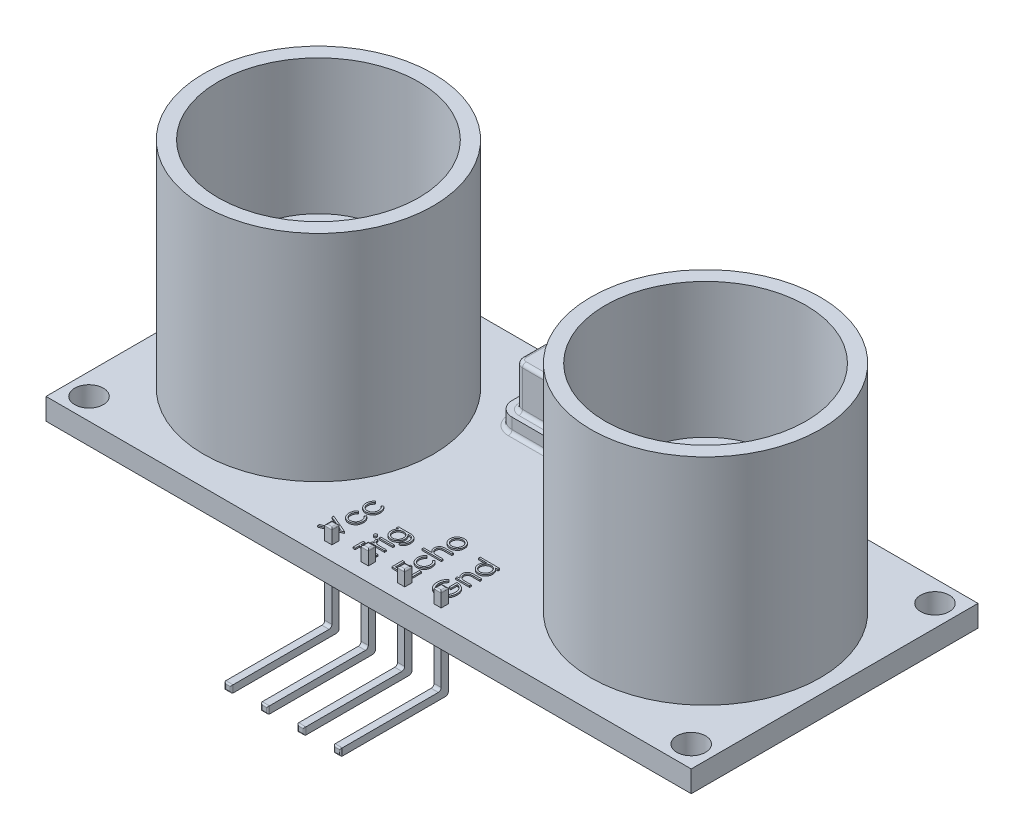
from build123d import *

# Parameters (mm, degrees)
SKETCH1_W                = 45
SKETCH1_H                = 20
SKETCH1_R                = 1
BOSS_EXTRUDE1_DEPTH      = 1.5
BOSS_EXTRUDE2_DEPTH      = 1
BOSS_EXTRUDE3_DEPTH      = 3
FILLET1_R                = 0.25
SKETCH5_R                = 8
BOSS_EXTRUDE4_DEPTH      = 15
SKETCH6_R                = 7
CUT_EXTRUDE1_DEPTH       = 13
SKETCH7_R                = 5
BOSS_EXTRUDE5_DEPTH      = 5
BOSS_EXTRUDE6_DEPTH      = 1
BOSS_EXTRUDE6_DEPTH_BACK = 5.5
SKETCH8_W                = 0.5
SKETCH8_H                = 0.5
SKETCH9_W                = 0.5
SKETCH9_H                = 0.5
BOSS_EXTRUDE7_DEPTH      = 7
LPATTERN1_COUNT          = 4
LPATTERN1_PITCH          = 2.54
FILLET3_R                = 0.2
FILLET2_R                = 0.1
SKETCH10_W               = 0.966746795
SKETCH10_H               = 0.118723291
BOSS_EXTRUDE8_DEPTH      = 0.1


with BuildPart() as part:
    # Sketch1 → Boss-Extrude1 (new body)
    with BuildSketch(Plane(origin=(0, 0, 0), x_dir=(1, 0, 0), z_dir=(0, 1, 0))):
        with Locations((22.5, 10)):
            Rectangle(SKETCH1_W, SKETCH1_H)
        with Locations(Location((1.5, 18.5, 0), (0, 0, 270))):
            Circle(SKETCH1_R, mode=Mode.SUBTRACT)
        with Locations(Location((43.5, 18.5, 0), (0, 0, 90))):
            Circle(SKETCH1_R, mode=Mode.SUBTRACT)
        with Locations(Location((43.5, 1.5, 0), (0, 0, 270))):
            Circle(SKETCH1_R, mode=Mode.SUBTRACT)
        with Locations(Location((1.5, 1.5, 0), (0, 0, 90))):
            Circle(SKETCH1_R, mode=Mode.SUBTRACT)
    extrude(amount=BOSS_EXTRUDE1_DEPTH)

    # Sketch2 → Boss-Extrude2 (add)
    with BuildSketch(Plane(origin=(0, 1.5, 0), x_dir=(1, 0, 0), z_dir=(0, 1, 0))):
        with BuildLine():
            Line((18.5, 19), (26.5, 19))
            ThreePointArc((26.5, 19), (27.207106781, 18.707106781), (27.5, 18))
            Line((27.5, 18), (27.5, 15))
            ThreePointArc((27.5, 15), (27.207106781, 14.292893219), (26.5, 14))
            Line((26.5, 14), (18.5, 14))
            ThreePointArc((18.5, 14), (17.792893219, 14.292893219), (17.5, 15))
            Line((17.5, 15), (17.5, 18))
            ThreePointArc((17.5, 18), (17.792893219, 18.707106781), (18.5, 19))
        make_face()
    extrude(amount=BOSS_EXTRUDE2_DEPTH)

    # Sketch4 → Boss-Extrude3 (add)
    with BuildSketch(Plane(origin=(0, 2.5, 0), x_dir=(1, 0, 0), z_dir=(0, 1, 0))):
        with BuildLine():
            Line((18.647529622, 18.413328726), (26.352470378, 18.413328726))
            ThreePointArc((26.352470378, 18.413328726), (26.706023768, 18.266882117), (26.852470378, 17.913328726))
            Line((26.852470378, 17.913328726), (26.852470378, 15.086671274))
            ThreePointArc((26.852470378, 15.086671274), (26.706023768, 14.733117883), (26.352470378, 14.586671274))
            Line((26.352470378, 14.586671274), (18.647529622, 14.586671274))
            ThreePointArc((18.647529622, 14.586671274), (18.293976232, 14.733117883), (18.147529622, 15.086671274))
            Line((18.147529622, 15.086671274), (18.147529622, 17.913328726))
            ThreePointArc((18.147529622, 17.913328726), (18.293976232, 18.266882117), (18.647529622, 18.413328726))
        make_face()
    extrude(amount=BOSS_EXTRUDE3_DEPTH)

    # Fillet1
    fillet1_edges = [part.edges().sort_by_distance(p)[0] for p in [
        (27.207106781, 1.5, -18.707106781),
        (22.5, 1.5, -19),
        (17.792893219, 1.5, -18.707106781),
        (17.5, 1.5, -16.5),
        (17.792893219, 1.5, -14.292893219),
        (22.5, 1.5, -14),
        (27.207106781, 1.5, -14.292893219),
        (27.5, 1.5, -16.5),
        (26.706023768, 2.5, -18.266882117),
        (22.5, 2.5, -18.413328726),
        (18.293976232, 2.5, -18.266882117),
        (18.147529622, 2.5, -16.5),
        (18.293976232, 2.5, -14.733117883),
        (22.5, 2.5, -14.586671274),
        (26.706023768, 2.5, -14.733117883),
        (26.852470378, 2.5, -16.5),
        (26.706023768, 5.5, -18.266882117),
        (22.5, 5.5, -18.413328726),
        (18.293976232, 5.5, -18.266882117),
        (18.147529622, 5.5, -16.5),
        (18.293976232, 5.5, -14.733117883),
        (22.5, 5.5, -14.586671274),
        (26.706023768, 5.5, -14.733117883),
        (26.852470378, 5.5, -16.5),
    ]]
    fillet(fillet1_edges, radius=FILLET1_R)

    # Sketch5 → Boss-Extrude4 (add)
    with BuildSketch(Plane(origin=(0, 1.5, 0), x_dir=(1, 0, 0), z_dir=(0, 1, 0))):
        with Locations(Location((9, 10, 0), (0, 0, 90))):
            Circle(SKETCH5_R)
        with Locations(Location((36, 10, 0), (0, 0, 90))):
            Circle(SKETCH5_R)
    extrude(amount=BOSS_EXTRUDE4_DEPTH)

    # Sketch6 → Cut-Extrude1 (cut)
    with BuildSketch(Plane(origin=(0, 16.5, 0), x_dir=(1, 0, 0), z_dir=(0, 1, 0))):
        with Locations(Location((9, 10, 0), (0, 0, 270))):
            Circle(SKETCH6_R)
        with Locations(Location((36, 10, 0), (0, 0, 270))):
            Circle(SKETCH6_R)
    extrude(amount=-CUT_EXTRUDE1_DEPTH, mode=Mode.SUBTRACT)

    # Sketch7 → Boss-Extrude5 (add)
    with BuildSketch(Plane(origin=(0, 3.5, 0), x_dir=(1, 0, 0), z_dir=(0, 1, 0))):
        with Locations(Location((9, 10, 0), (0, 0, 90))):
            Circle(SKETCH7_R)
        with Locations(Location((36, 10, 0), (0, 0, 90))):
            Circle(SKETCH7_R)
    extrude(amount=BOSS_EXTRUDE5_DEPTH)

    # Sketch8 → Boss-Extrude6 (add, two sides: drawn at the far end of the back side and taken through both)
    with BuildSketch(Plane(origin=(0, 1.5, 0), x_dir=(1, 0, 0), z_dir=(0, 1, 0)).offset(-BOSS_EXTRUDE6_DEPTH_BACK)):
        with Locations((21.23, 1.25)):
            Rectangle(SKETCH8_W, SKETCH8_H)
        with Locations((23.77, 1.25)):
            Rectangle(SKETCH8_W, SKETCH8_H)
        with Locations((26.31, 1.25)):
            Rectangle(SKETCH8_W, SKETCH8_H)
        with Locations((18.69, 1.25)):
            Rectangle(SKETCH8_W, SKETCH8_H)
    extrude(amount=BOSS_EXTRUDE6_DEPTH + BOSS_EXTRUDE6_DEPTH_BACK)

    # Sketch9 → Boss-Extrude7 (add)
    with BuildSketch(Plane.XY.offset(-1)):
        with Locations((18.69, -3.75)):
            Rectangle(SKETCH9_W, SKETCH9_H)
    boss_extrude7 = extrude(amount=BOSS_EXTRUDE7_DEPTH)

    # LPattern1: Boss-Extrude7 ×4
    with Locations(*[(i * LPATTERN1_PITCH, 0, 0) for i in range(1, LPATTERN1_COUNT)]):
        add(boss_extrude7)

    # Fillet3
    fillet3_edges = [part.edges().sort_by_distance(p)[0] for p in [
        (21.23, -4, -1.5),
        (23.77, -4, -1.5),
        (26.31, -4, -1.5),
        (18.69, -4, -1.5),
        (18.69, -3.5, -1),
        (21.23, -3.5, -1),
        (23.77, -3.5, -1),
        (26.31, -3.5, -1),
    ]]
    fillet(fillet3_edges, radius=FILLET3_R)

    # Fillet2
    fillet2_edges = [part.edges().sort_by_distance(p)[0] for p in [
        (20.98, 2.5, -1.25),
        (21.23, 2.5, -1),
        (21.48, 2.5, -1.25),
        (21.23, 2.5, -1.5),
        (23.52, 2.5, -1.25),
        (23.77, 2.5, -1),
        (24.02, 2.5, -1.25),
        (23.77, 2.5, -1.5),
        (26.06, 2.5, -1.25),
        (26.31, 2.5, -1),
        (26.56, 2.5, -1.25),
        (26.31, 2.5, -1.5),
        (18.44, 2.5, -1.25),
        (18.69, 2.5, -1),
        (18.94, 2.5, -1.25),
        (18.69, 2.5, -1.5),
        (18.44, -3.75, 6),
        (18.69, -4, 6),
        (18.94, -3.75, 6),
        (18.69, -3.5, 6),
        (20.98, -3.75, 6),
        (21.23, -4, 6),
        (21.48, -3.75, 6),
        (21.23, -3.5, 6),
        (23.52, -3.75, 6),
        (23.77, -4, 6),
        (24.02, -3.75, 6),
        (23.77, -3.5, 6),
        (26.06, -3.75, 6),
        (26.31, -4, 6),
        (26.56, -3.75, 6),
        (26.31, -3.5, 6),
    ]]
    fillet(fillet2_edges, radius=FILLET2_R)

    # Sketch10 → Boss-Extrude8 (add)
    # profile 1 of 15: a face of its own
    with BuildSketch(Plane(origin=(0, 1.5, 0), x_dir=(1, 0, 0), z_dir=(0, 1, 0))):
        Polygon((17.367083333, 1.56784188), (17.367083333, 1.695045406), (18.409622229, 2.136017628), (17.367083333, 2.57698985), (17.367083333, 2.704193376), (18.69, 2.144497863), (18.69, 2.127537393), align=None)
    # profile 2 of 15: a face of its own
    with BuildSketch(Plane(origin=(0, 1.5, 0), x_dir=(1, 0, 0), z_dir=(0, 1, 0))):
        with BuildLine():
            Line((17.932874015, 3.874465812), (17.994620726, 3.775088058))
            add(Edge.make_bspline(
                [(17.994620726, 3.775088058), (17.981078447, 3.764191055), (17.954422768, 3.742742155), (17.92002318, 3.70549667), (17.8904779, 3.665804856), (17.866399398, 3.622988451), (17.847794862, 3.577107508), (17.834629874, 3.528342966), (17.826426187, 3.476701779), (17.825493781, 3.441298564), (17.825016026, 3.423158303)],
                knots=[0, 0, 0, 0, 1.026593902, 2.0206758, 2.988051866, 3.946915611, 4.916868779, 5.907761954, 6.927957743, 8, 8, 8, 8], degree=3))
            add(Edge.make_bspline(
                [(17.825016026, 3.423158303), (17.825415487, 3.408659531), (17.826202215, 3.380104593), (17.831119872, 3.338184707), (17.840055988, 3.298254413), (17.851830308, 3.260063431), (17.867610923, 3.223883392), (17.886815801, 3.189619503), (17.909135311, 3.156967845), (17.934992868, 3.126874612), (17.963113793, 3.099346981), (17.993258791, 3.075497094), (18.02452494, 3.054732242), (18.057693009, 3.038439216), (18.092004196, 3.025106042), (18.12810616, 3.016334454), (18.165536389, 3.010489167), (18.191056713, 3.009820403), (18.203976529, 3.009481838)],
                knots=[0, 0, 0, 0, 1.112346261, 2.190735716, 3.231507886, 4.247384806, 5.251966152, 6.253067467, 7.256802811, 8.280671706, 9.291813951, 10.270744147, 11.225547591, 12.165006084, 13.100104208, 14.043489273, 15.009504848, 16, 16, 16, 16], degree=3))
            add(Edge.make_bspline(
                [(18.203976529, 3.009481838), (18.220895807, 3.010164545), (18.254592969, 3.011524255), (18.30424988, 3.0218659), (18.352171356, 3.039170198), (18.398098323, 3.062547501), (18.440652535, 3.092221132), (18.478822857, 3.127057213), (18.511863772, 3.167092894), (18.539256733, 3.211970671), (18.561278123, 3.260638092), (18.576966912, 3.312568264), (18.586436111, 3.367336936), (18.587628983, 3.404834723), (18.588237179, 3.423953325)],
                knots=[0, 0, 0, 0, 0.96628757, 1.924499989, 2.884001032, 3.87047137, 4.860396324, 5.839257425, 6.814467993, 7.816059692, 8.834901047, 9.858382822, 10.908076205, 12, 12, 12, 12], degree=3))
            add(Edge.make_bspline(
                [(18.588237179, 3.423953325), (18.587746, 3.441474481), (18.586780703, 3.475908202), (18.578643268, 3.526242265), (18.565322013, 3.574162053), (18.546745372, 3.619665862), (18.522733484, 3.662670544), (18.493115583, 3.702898238), (18.458743713, 3.741149405), (18.432165194, 3.763637846), (18.418632479, 3.775088058)],
                knots=[0, 0, 0, 0, 1.039848629, 2.043578496, 3.018386758, 3.987534228, 4.954977003, 5.934852016, 6.948509513, 8, 8, 8, 8], degree=3))
            Line((18.418632479, 3.775088058), (18.483824286, 3.874465812))
            add(Edge.make_bspline(
                [(18.483824286, 3.874465812), (18.492476435, 3.868574032), (18.509752017, 3.856810027), (18.534110359, 3.837144823), (18.556910519, 3.815932863), (18.578121934, 3.793256901), (18.598252197, 3.769413025), (18.616338953, 3.743586702), (18.633398841, 3.716610688), (18.64874954, 3.688168298), (18.66254806, 3.6585536), (18.674413176, 3.627808264), (18.684607233, 3.596065895), (18.69271004, 3.563289169), (18.69917753, 3.529413469), (18.703468958, 3.494526405), (18.706672413, 3.458639992), (18.706863619, 3.434384447), (18.70696047, 3.422098274)],
                knots=[0, 0, 0, 0, 0.954134338, 1.905101784, 2.851144739, 3.791306361, 4.734911809, 5.6936923, 6.663572882, 7.643865596, 8.638447847, 9.640600242, 10.646758161, 11.676244097, 12.717260333, 13.78922464, 14.880174919, 16, 16, 16, 16], degree=3))
            add(Edge.make_bspline(
                [(18.70696047, 3.422098274), (18.706623028, 3.403346786), (18.705961639, 3.366593735), (18.698709188, 3.312795755), (18.687735226, 3.261398394), (18.672118193, 3.212311332), (18.65149411, 3.165834665), (18.626878531, 3.121581475), (18.597457983, 3.080008426), (18.563931401, 3.041388056), (18.527543724, 3.006069741), (18.488505212, 2.975337252), (18.447678502, 2.949292428), (18.404806253, 2.927837553), (18.360064262, 2.911061842), (18.313179197, 2.899512363), (18.264548852, 2.892060247), (18.231388304, 2.891196462), (18.214576823, 2.890758547)],
                knots=[0, 0, 0, 0, 1.113096611, 2.181677437, 3.217994567, 4.231807234, 5.234933164, 6.233258928, 7.234764453, 8.254006763, 9.267004511, 10.242118657, 11.199842941, 12.138404996, 13.084707599, 14.031460992, 15.002005182, 16, 16, 16, 16], degree=3))
            add(Edge.make_bspline(
                [(18.214576823, 2.890758547), (18.203170093, 2.890925241), (18.180480225, 2.891256822), (18.146804411, 2.895059991), (18.113577074, 2.899973104), (18.081219394, 2.908298308), (18.049240609, 2.917914261), (18.018026163, 2.930189239), (17.987431004, 2.944588391), (17.957533946, 2.960936598), (17.928826828, 2.979339784), (17.901705651, 2.999705607), (17.875844609, 3.021267008), (17.852136521, 3.045032681), (17.829633258, 3.069994098), (17.808935991, 3.096857462), (17.78998389, 3.125468691), (17.772426512, 3.155398102), (17.75679363, 3.186628276), (17.743325115, 3.21897044), (17.731814766, 3.25222971), (17.722702169, 3.286459288), (17.715060464, 3.321431978), (17.710253421, 3.357423377), (17.706856824, 3.394295794), (17.706482328, 3.419263398), (17.706292735, 3.431903546)],
                knots=[0, 0, 0, 0, 0.990994727, 1.971252077, 2.943264845, 3.907940874, 4.872158414, 5.844625996, 6.82015047, 7.809835459, 8.804511986, 9.781214284, 10.756496977, 11.728388426, 12.696359165, 13.676225489, 14.672885716, 15.677705647, 16.690706858, 17.706033469, 18.721040654, 19.747369689, 20.783475414, 21.830280724, 22.901553713, 24, 24, 24, 24], degree=3))
            add(Edge.make_bspline(
                [(17.706292735, 3.431903546), (17.706641152, 3.447733249), (17.707336244, 3.479313532), (17.713187342, 3.526159875), (17.722005936, 3.57231761), (17.735081122, 3.616970323), (17.750877706, 3.659600482), (17.768723381, 3.699399693), (17.789007628, 3.735766907), (17.811606262, 3.769022904), (17.837349713, 3.799158469), (17.865975945, 3.826945987), (17.897691011, 3.852568538), (17.921049559, 3.867106482), (17.932874015, 3.874465812)],
                knots=[0, 0, 0, 0, 1.095139042, 2.184804066, 3.262657822, 4.34424993, 5.400369085, 6.407210964, 7.359649996, 8.278719237, 9.185177137, 10.097389079, 11.036869154, 12, 12, 12, 12], degree=3))
        make_face()
    # profile 3 of 15: a face of its own
    with BuildSketch(Plane(origin=(0, 1.5, 0), x_dir=(1, 0, 0), z_dir=(0, 1, 0))):
        with BuildLine():
            Line((17.932874015, 5.061698718), (17.994620726, 4.962320964))
            add(Edge.make_bspline(
                [(17.994620726, 4.962320964), (17.981078447, 4.951423961), (17.954422768, 4.929975061), (17.92002318, 4.892729576), (17.8904779, 4.853037762), (17.866399398, 4.810221357), (17.847794862, 4.764340414), (17.834629874, 4.715575872), (17.826426187, 4.663934685), (17.825493781, 4.62853147), (17.825016026, 4.610391209)],
                knots=[0, 0, 0, 0, 1.026593902, 2.0206758, 2.988051866, 3.946915611, 4.916868779, 5.907761954, 6.927957743, 8, 8, 8, 8], degree=3))
            add(Edge.make_bspline(
                [(17.825016026, 4.610391209), (17.825415487, 4.595892437), (17.826202215, 4.567337499), (17.831119872, 4.525417613), (17.840055988, 4.485487319), (17.851830308, 4.447296337), (17.867610923, 4.411116298), (17.886815801, 4.376852409), (17.909135311, 4.344200751), (17.934992868, 4.314107518), (17.963113793, 4.286579887), (17.993258791, 4.26273), (18.02452494, 4.241965148), (18.057693009, 4.225672122), (18.092004196, 4.212338948), (18.12810616, 4.20356736), (18.165536389, 4.197722073), (18.191056713, 4.197053309), (18.203976529, 4.196714744)],
                knots=[0, 0, 0, 0, 1.112346261, 2.190735716, 3.231507886, 4.247384806, 5.251966152, 6.253067467, 7.256802811, 8.280671706, 9.291813951, 10.270744147, 11.225547591, 12.165006084, 13.100104208, 14.043489273, 15.009504848, 16, 16, 16, 16], degree=3))
            add(Edge.make_bspline(
                [(18.203976529, 4.196714744), (18.220895807, 4.197397451), (18.254592969, 4.198757161), (18.30424988, 4.209098806), (18.352171356, 4.226403104), (18.398098323, 4.249780407), (18.440652535, 4.279454038), (18.478822857, 4.314290119), (18.511863772, 4.3543258), (18.539256733, 4.399203577), (18.561278123, 4.447870998), (18.576966912, 4.49980117), (18.586436111, 4.554569841), (18.587628983, 4.592067629), (18.588237179, 4.611186231)],
                knots=[0, 0, 0, 0, 0.96628757, 1.924499989, 2.884001032, 3.87047137, 4.860396324, 5.839257425, 6.814467993, 7.816059692, 8.834901047, 9.858382822, 10.908076205, 12, 12, 12, 12], degree=3))
            add(Edge.make_bspline(
                [(18.588237179, 4.611186231), (18.587746, 4.628707387), (18.586780703, 4.663141108), (18.578643268, 4.713475171), (18.565322013, 4.761394959), (18.546745372, 4.806898768), (18.522733484, 4.84990345), (18.493115583, 4.890131144), (18.458743713, 4.928382311), (18.432165194, 4.950870752), (18.418632479, 4.962320964)],
                knots=[0, 0, 0, 0, 1.039848629, 2.043578496, 3.018386758, 3.987534228, 4.954977003, 5.934852016, 6.948509513, 8, 8, 8, 8], degree=3))
            Line((18.418632479, 4.962320964), (18.483824286, 5.061698718))
            add(Edge.make_bspline(
                [(18.483824286, 5.061698718), (18.492476435, 5.055806938), (18.509752017, 5.044042933), (18.534110359, 5.024377729), (18.556910519, 5.003165769), (18.578121934, 4.980489807), (18.598252197, 4.956645931), (18.616338953, 4.930819608), (18.633398841, 4.903843594), (18.64874954, 4.875401204), (18.66254806, 4.845786506), (18.674413176, 4.81504117), (18.684607233, 4.783298801), (18.69271004, 4.750522075), (18.69917753, 4.716646375), (18.703468958, 4.681759311), (18.706672413, 4.645872898), (18.706863619, 4.621617353), (18.70696047, 4.60933118)],
                knots=[0, 0, 0, 0, 0.954134338, 1.905101784, 2.851144739, 3.791306361, 4.734911809, 5.6936923, 6.663572882, 7.643865596, 8.638447847, 9.640600242, 10.646758161, 11.676244097, 12.717260333, 13.78922464, 14.880174919, 16, 16, 16, 16], degree=3))
            add(Edge.make_bspline(
                [(18.70696047, 4.60933118), (18.706623028, 4.590579692), (18.705961639, 4.553826641), (18.698709188, 4.500028661), (18.687735226, 4.4486313), (18.672118193, 4.399544238), (18.65149411, 4.353067571), (18.626878531, 4.308814381), (18.597457983, 4.267241332), (18.563931401, 4.228620962), (18.527543724, 4.193302647), (18.488505212, 4.162570158), (18.447678502, 4.136525334), (18.404806253, 4.115070459), (18.360064262, 4.098294748), (18.313179197, 4.086745269), (18.264548852, 4.079293153), (18.231388304, 4.078429368), (18.214576823, 4.077991453)],
                knots=[0, 0, 0, 0, 1.113096611, 2.181677437, 3.217994567, 4.231807234, 5.234933164, 6.233258928, 7.234764453, 8.254006763, 9.267004511, 10.242118657, 11.199842941, 12.138404996, 13.084707599, 14.031460992, 15.002005182, 16, 16, 16, 16], degree=3))
            add(Edge.make_bspline(
                [(18.214576823, 4.077991453), (18.203170093, 4.078158147), (18.180480225, 4.078489728), (18.146804411, 4.082292897), (18.113577074, 4.08720601), (18.081219394, 4.095531214), (18.049240609, 4.105147167), (18.018026163, 4.117422145), (17.987431004, 4.131821297), (17.957533946, 4.148169504), (17.928826828, 4.16657269), (17.901705651, 4.186938513), (17.875844609, 4.208499914), (17.852136521, 4.232265587), (17.829633258, 4.257227004), (17.808935991, 4.284090368), (17.78998389, 4.312701597), (17.772426512, 4.342631008), (17.75679363, 4.373861182), (17.743325115, 4.406203346), (17.731814766, 4.439462616), (17.722702169, 4.473692194), (17.715060464, 4.508664884), (17.710253421, 4.544656283), (17.706856824, 4.5815287), (17.706482328, 4.606496304), (17.706292735, 4.619136452)],
                knots=[0, 0, 0, 0, 0.990994727, 1.971252077, 2.943264845, 3.907940874, 4.872158414, 5.844625996, 6.82015047, 7.809835459, 8.804511986, 9.781214284, 10.756496977, 11.728388426, 12.696359165, 13.676225489, 14.672885716, 15.677705647, 16.690706858, 17.706033469, 18.721040654, 19.747369689, 20.783475414, 21.830280724, 22.901553713, 24, 24, 24, 24], degree=3))
            add(Edge.make_bspline(
                [(17.706292735, 4.619136452), (17.706641152, 4.634966155), (17.707336244, 4.666546437), (17.713187342, 4.713392781), (17.722005936, 4.759550516), (17.735081122, 4.804203229), (17.750877706, 4.846833388), (17.768723381, 4.886632599), (17.789007628, 4.922999813), (17.811606262, 4.95625581), (17.837349713, 4.986391375), (17.865975945, 5.014178893), (17.897691011, 5.039801444), (17.921049559, 5.054339388), (17.932874015, 5.061698718)],
                knots=[0, 0, 0, 0, 1.095139042, 2.184804066, 3.262657822, 4.34424993, 5.400369085, 6.407210964, 7.359649996, 8.278719237, 9.185177137, 10.097389079, 11.036869154, 12, 12, 12, 12], degree=3))
        make_face()
    # profile 4 of 15: a face of its own
    with BuildSketch(Plane(origin=(0, 1.5, 0), x_dir=(1, 0, 0), z_dir=(0, 1, 0))):
        Polygon((20.042767094, 1.51696047), (19.907083333, 1.51696047), (19.907083333, 2.212339744), (20.042767094, 2.212339744), (20.042767094, 1.924011752), (21.23, 1.924011752), (21.23, 1.805288462), (20.042767094, 1.805288462), align=None)
    # profile 5 of 15: a face of its own
    with BuildSketch(Plane(origin=(0, 1.5, 0), x_dir=(1, 0, 0), z_dir=(0, 1, 0))):
        with BuildLine():
            Line((20.263253205, 2.381944444), (20.263253205, 2.500667735))
            Line((20.263253205, 2.500667735), (20.405562149, 2.500667735))
            add(Edge.make_bspline(
                [(20.405562149, 2.500667735), (20.392305949, 2.509426926), (20.366953569, 2.52617881), (20.333468425, 2.554152759), (20.305427447, 2.582500812), (20.283365381, 2.611967337), (20.266691847, 2.642263439), (20.254975877, 2.673133645), (20.247710448, 2.704653445), (20.246765939, 2.725886432), (20.246292735, 2.736524272)],
                knots=[0, 0, 0, 0, 1.280091057, 2.448164201, 3.510831157, 4.48793739, 5.405868014, 6.289422536, 7.142991551, 8, 8, 8, 8], degree=3))
            add(Edge.make_bspline(
                [(20.246292735, 2.736524272), (20.246742726, 2.744774104), (20.247668611, 2.761748669), (20.254173893, 2.787444469), (20.264559931, 2.813919226), (20.27432692, 2.830981974), (20.279418653, 2.839877137)],
                knots=[0, 0, 0, 0, 0.901110191, 1.854092781, 2.881294221, 4, 4, 4, 4], degree=3))
            Line((20.279418653, 2.839877137), (20.382241503, 2.77468533))
            add(Edge.make_bspline(
                [(20.382241503, 2.77468533), (20.379693843, 2.76897448), (20.374857896, 2.758134193), (20.369134577, 2.742276365), (20.365764573, 2.727655741), (20.365254034, 2.718341063), (20.365016026, 2.713998648)],
                knots=[0, 0, 0, 0, 1.180555205, 2.24091978, 3.179933427, 4, 4, 4, 4], degree=3))
            add(Edge.make_bspline(
                [(20.365016026, 2.713998648), (20.365646067, 2.70446862), (20.366931168, 2.685030127), (20.377178354, 2.656586914), (20.393258527, 2.628739377), (20.411569089, 2.606836324), (20.429157985, 2.589817241), (20.444552148, 2.577577549), (20.461973375, 2.566592243), (20.480748296, 2.555936204), (20.501348109, 2.54603594), (20.523806419, 2.537188599), (20.547937775, 2.528914632), (20.564716869, 2.524255115), (20.573311799, 2.521868323)],
                knots=[0, 0, 0, 0, 1.125322384, 2.295331465, 3.535939348, 4.916963136, 5.656144286, 6.429838446, 7.238666481, 8.090384391, 8.983239461, 9.940052224, 10.944811494, 12, 12, 12, 12], degree=3))
            add(Edge.make_bspline(
                [(20.573311799, 2.521868323), (20.580975663, 2.520076499), (20.598035665, 2.516087844), (20.626526528, 2.512313226), (20.66016589, 2.508433533), (20.69899283, 2.505784094), (20.743156601, 2.503281345), (20.792466679, 2.501898723), (20.847058594, 2.500711725), (20.885136241, 2.500682866), (20.905100995, 2.500667735)],
                knots=[0, 0, 0, 0, 0.566841273, 1.261806378, 2.068780918, 3.007109044, 4.065315289, 5.256255371, 6.561408263, 8, 8, 8, 8], degree=3))
            Line((20.905100995, 2.500667735), (21.23, 2.500667735))
            Line((21.23, 2.500667735), (21.23, 2.381944444))
            Line((21.23, 2.381944444), (20.263253205, 2.381944444))
        make_face()
    # profile 6 of 15: a face of its own
    with BuildSketch(Plane(origin=(0, 1.5, 0), x_dir=(1, 0, 0), z_dir=(0, 1, 0))):
        with BuildLine():
            add(Edge.make_bspline(
                [(19.856201923, 3.017432058), (19.856543671, 3.024799311), (19.85721288, 3.039225808), (19.862943557, 3.060087549), (19.872657426, 3.079083503), (19.885689925, 3.095932825), (19.901016649, 3.110391127), (19.918880169, 3.120513598), (19.938179119, 3.127019474), (19.951640775, 3.127805118), (19.958494758, 3.128205128)],
                knots=[0, 0, 0, 0, 1.055194115, 2.066272739, 3.074728998, 4.095836921, 5.109056067, 6.073838105, 7.019297344, 8, 8, 8, 8], degree=3))
            add(Edge.make_bspline(
                [(19.958494758, 3.128205128), (19.965170821, 3.127796098), (19.978368606, 3.126987492), (19.997332984, 3.120518623), (20.014948293, 3.110304861), (20.030245258, 3.095942096), (20.043270552, 3.079081046), (20.052986331, 3.060088202), (20.058716502, 3.039225636), (20.05938578, 3.024799253), (20.059727564, 3.017432058)],
                knots=[0, 0, 0, 0, 0.96129708, 1.900370562, 2.859976407, 3.87933698, 4.906634145, 5.921202961, 6.938410037, 8, 8, 8, 8], degree=3))
            add(Edge.make_bspline(
                [(20.059727564, 3.017432058), (20.059398831, 3.010149109), (20.058758994, 2.9959738), (20.052873898, 2.975424428), (20.043267227, 2.956590445), (20.030330544, 2.939708262), (20.014854348, 2.925636136), (19.997343734, 2.915393614), (19.978365869, 2.908939685), (19.965169901, 2.908129066), (19.958494758, 2.907719017)],
                knots=[0, 0, 0, 0, 1.054934014, 2.053291228, 3.073705704, 4.106921865, 5.123545215, 6.088680038, 7.033164197, 8, 8, 8, 8], degree=3))
            add(Edge.make_bspline(
                [(19.958494758, 2.907719017), (19.951641729, 2.908120083), (19.938181947, 2.9089078), (19.918869241, 2.915398452), (19.901111352, 2.925550819), (19.88560469, 2.93971758), (19.872660731, 2.956587965), (19.863055985, 2.975425068), (19.857170389, 2.99597363), (19.856530621, 3.010149051), (19.856201923, 3.017432058)],
                knots=[0, 0, 0, 0, 0.98631895, 1.937192651, 2.907499808, 3.917963147, 4.944918757, 5.95915025, 6.951458133, 8, 8, 8, 8], degree=3))
        make_face()
    # profile 7 of 15: a face of its own
    with BuildSketch(Plane(origin=(0, 1.5, 0), x_dir=(1, 0, 0), z_dir=(0, 1, 0))):
        with Locations((20.746626603, 3.017962073)):
            Rectangle(SKETCH10_W, SKETCH10_H)
    # profile 8 of 15: a face of its own
    with BuildSketch(Plane(origin=(0, 1.5, 0), x_dir=(1, 0, 0), z_dir=(0, 1, 0))):
        with BuildLine():
            Line((20.263253205, 4.196714744), (20.263253205, 4.315438034))
            Line((20.263253205, 4.315438034), (21.030449469, 4.315438034))
            add(Edge.make_bspline(
                [(21.030449469, 4.315438034), (21.04679225, 4.315333319), (21.078337755, 4.315131193), (21.123951271, 4.313675617), (21.166082798, 4.310606194), (21.204924485, 4.307125532), (21.240296294, 4.302118589), (21.272303773, 4.296004307), (21.300977638, 4.289111655), (21.318638515, 4.283056394), (21.326992688, 4.280192057)],
                knots=[0, 0, 0, 0, 1.307562039, 2.523909702, 3.650326591, 4.686913197, 5.643429486, 6.506965704, 7.293745905, 8, 8, 8, 8], degree=3))
            add(Edge.make_bspline(
                [(21.326992688, 4.280192057), (21.337851889, 4.275962771), (21.359245608, 4.267630651), (21.389572636, 4.252025959), (21.418126018, 4.234549555), (21.44475472, 4.214593896), (21.469294922, 4.192225004), (21.492355447, 4.168099787), (21.513068715, 4.14137188), (21.531683505, 4.112509303), (21.548777058, 4.082094804), (21.563360489, 4.049899684), (21.57552369, 4.016096906), (21.585531894, 3.980842441), (21.593606075, 3.944138346), (21.598993284, 3.905862442), (21.602620794, 3.866144079), (21.602958837, 3.839139888), (21.603130342, 3.825439453)],
                knots=[0, 0, 0, 0, 0.98202571, 1.934689484, 2.871054655, 3.802072519, 4.735470746, 5.668036537, 6.612630213, 7.581518814, 8.561763468, 9.551722253, 10.55777311, 11.588015789, 12.63986657, 13.723744117, 14.845153492, 16, 16, 16, 16], degree=3))
            add(Edge.make_bspline(
                [(21.603130342, 3.825439453), (21.602766013, 3.805455874), (21.60205457, 3.766433032), (21.595254214, 3.709422673), (21.584285149, 3.655455223), (21.568656791, 3.604924001), (21.549330905, 3.558337418), (21.527192062, 3.515955641), (21.501793966, 3.478169343), (21.472879108, 3.444104638), (21.438496849, 3.413359482), (21.397978285, 3.38443398), (21.350705964, 3.3565919), (21.316010506, 3.340275183), (21.29784188, 3.331730769)],
                knots=[0, 0, 0, 0, 1.157856589, 2.260999188, 3.322382479, 4.345906448, 5.321474636, 6.242187631, 7.112686896, 7.955149481, 8.825136643, 9.778649332, 10.836767353, 12, 12, 12, 12], degree=3))
            Line((21.29784188, 3.331730769), (21.29784188, 3.45045406))
            add(Edge.make_bspline(
                [(21.29784188, 3.45045406), (21.312996086, 3.460006902), (21.342620693, 3.478681533), (21.381016099, 3.513487821), (21.413528041, 3.551912836), (21.439907752, 3.594771874), (21.460215777, 3.642363854), (21.474321506, 3.694996679), (21.482855391, 3.752814388), (21.483875724, 3.79307755), (21.484407051, 3.814044137)],
                knots=[0, 0, 0, 0, 0.997887113, 1.950746426, 2.877762071, 3.798308985, 4.747694893, 5.754452072, 6.830656281, 8, 8, 8, 8], degree=3))
            add(Edge.make_bspline(
                [(21.484407051, 3.814044137), (21.483868751, 3.83474563), (21.482830961, 3.874656035), (21.474318118, 3.932032407), (21.460211389, 3.98449355), (21.439949176, 4.03146005), (21.415611057, 4.072639719), (21.388693764, 4.108343454), (21.357982012, 4.137032794), (21.329731725, 4.156403129), (21.304547027, 4.168432762), (21.282870511, 4.176100491), (21.258437653, 4.182284425), (21.23119015, 4.187592882), (21.201117545, 4.191799234), (21.16811728, 4.194559024), (21.132412563, 4.196517786), (21.107657915, 4.196647573), (21.094846254, 4.196714744)],
                knots=[0, 0, 0, 0, 1.570880491, 3.028500349, 4.391799536, 5.683507043, 6.897971719, 8.016608159, 9.065046722, 10.074948333, 10.602832593, 11.179761774, 11.817338097, 12.514350094, 13.286299219, 14.121078732, 15.027572402, 16, 16, 16, 16], degree=3))
            Line((21.094846254, 4.196714744), (21.044759866, 4.196714744))
            add(Edge.make_bspline(
                [(21.044759866, 4.196714744), (21.059095143, 4.184660382), (21.087513545, 4.160763692), (21.124818384, 4.119605962), (21.156558911, 4.074367626), (21.182960673, 4.025688142), (21.203878494, 3.974292998), (21.219035282, 3.921090866), (21.228436614, 3.866231105), (21.229475175, 3.829098533), (21.23, 3.810334034)],
                knots=[0, 0, 0, 0, 1.012670515, 2.007528466, 2.995541538, 3.996581493, 4.997861088, 5.991949332, 6.98525577, 8, 8, 8, 8], degree=3))
            add(Edge.make_bspline(
                [(21.23, 3.810334034), (21.229766839, 3.799287617), (21.229303451, 3.777333728), (21.226484629, 3.74462602), (21.220995432, 3.712548671), (21.213966489, 3.680897347), (21.204544388, 3.649893171), (21.193485854, 3.619164656), (21.179903049, 3.589158054), (21.164610675, 3.559720261), (21.14742863, 3.531543855), (21.128864788, 3.504717427), (21.108958722, 3.479405971), (21.087529286, 3.455843983), (21.064603521, 3.434064058), (21.040426867, 3.413772815), (21.01466145, 3.395305906), (20.987777157, 3.378284356), (20.959594902, 3.363521532), (20.9307258, 3.350562856), (20.901231579, 3.339295611), (20.871013493, 3.330312855), (20.840090592, 3.323452166), (20.808513536, 3.318345622), (20.776185086, 3.315449216), (20.754405588, 3.314997563), (20.743446514, 3.314770299)],
                knots=[0, 0, 0, 0, 1.028710361, 2.044481286, 3.053267669, 4.056977562, 5.061496029, 6.068537106, 7.095799505, 8.125955792, 9.155750787, 10.166547241, 11.162135275, 12.151998358, 13.129411568, 14.10464185, 15.088574784, 16.079052837, 17.065149435, 18.048153627, 19.024354702, 20.002874835, 20.980703288, 21.971932454, 22.97951087, 24, 24, 24, 24], degree=3))
            add(Edge.make_bspline(
                [(20.743446514, 3.314770299), (20.732484035, 3.314966532), (20.710601534, 3.315358237), (20.678141172, 3.318741494), (20.646115462, 3.323567565), (20.61485451, 3.331205621), (20.584002297, 3.340398955), (20.553786708, 3.351784948), (20.52419854, 3.365474777), (20.49521588, 3.380975486), (20.467227645, 3.398394176), (20.440645847, 3.41749425), (20.415666092, 3.438298768), (20.392036373, 3.460520713), (20.369984677, 3.484431417), (20.349564527, 3.510018513), (20.33043363, 3.53702978), (20.313004643, 3.565548934), (20.297589924, 3.595135923), (20.283524449, 3.625039062), (20.272361255, 3.655654467), (20.262525143, 3.686411349), (20.255557078, 3.717851377), (20.250181409, 3.749589052), (20.246906351, 3.781733031), (20.246497538, 3.803259869), (20.246292735, 3.814044137)],
                knots=[0, 0, 0, 0, 1.008818848, 2.013730394, 3.001654427, 3.987803273, 4.973046549, 5.963777569, 6.957074694, 7.972068341, 8.987420212, 9.989399531, 10.982630087, 11.977756091, 12.973280677, 13.973972381, 14.989194003, 16.018387222, 17.047741039, 18.059210846, 19.057554164, 20.045176975, 21.029480261, 22.018708529, 23.007435371, 24, 24, 24, 24], degree=3))
            add(Edge.make_bspline(
                [(20.246292735, 3.814044137), (20.246805525, 3.831828272), (20.247818128, 3.866946473), (20.255763621, 3.918627537), (20.26843112, 3.968498562), (20.286579885, 4.016840967), (20.311356239, 4.064048549), (20.343991817, 4.109965723), (20.384779356, 4.154725336), (20.416057969, 4.182347016), (20.432327891, 4.196714744)],
                knots=[0, 0, 0, 0, 0.96728863, 1.910097829, 2.838038873, 3.762875196, 4.71315279, 5.730631239, 6.819562287, 8, 8, 8, 8], degree=3))
            Line((20.432327891, 4.196714744), (20.263253205, 4.196714744))
        make_face()
        with BuildLine():
            add(Edge.make_bspline(
                [(20.365016026, 3.823584402), (20.365608237, 3.806224793), (20.366780689, 3.77185645), (20.376721938, 3.721460546), (20.392456864, 3.672920621), (20.414358038, 3.626715285), (20.442037232, 3.583908927), (20.474968225, 3.545600698), (20.512699234, 3.512201331), (20.554744197, 3.483940542), (20.600175159, 3.46136444), (20.648040741, 3.445594088), (20.697504809, 3.435170066), (20.731203305, 3.434056032), (20.748216647, 3.43349359)],
                knots=[0, 0, 0, 0, 1.026191648, 2.031641866, 3.026511193, 4.038688626, 5.047555432, 6.033268986, 7.01798463, 8.019529538, 9.022150945, 10.008736843, 10.994672018, 12, 12, 12, 12], degree=3))
            add(Edge.make_bspline(
                [(20.748216647, 3.43349359), (20.7610422, 3.433769011), (20.786266313, 3.434310683), (20.82329043, 3.439482156), (20.858607758, 3.44794274), (20.892184753, 3.459631854), (20.924025694, 3.474568252), (20.95412836, 3.492990595), (20.9825096, 3.514796004), (21.008929925, 3.539684846), (21.032991768, 3.567118085), (21.054135146, 3.596871777), (21.071427794, 3.628907321), (21.086373299, 3.662436362), (21.097288896, 3.698272576), (21.105619031, 3.735899759), (21.110384841, 3.775584121), (21.110975541, 3.802636534), (21.111276709, 3.816429203)],
                knots=[0, 0, 0, 0, 1.039710933, 2.044807362, 3.024849673, 3.981007225, 4.923240656, 5.871799057, 6.837597342, 7.820855272, 8.810901995, 9.792827897, 10.773995565, 11.758948565, 12.765014796, 13.806304263, 14.881544521, 16, 16, 16, 16], degree=3))
            add(Edge.make_bspline(
                [(21.111276709, 3.816429203), (21.110986571, 3.830400624), (21.11041921, 3.857721589), (21.105541995, 3.897624889), (21.097671783, 3.935434883), (21.086497664, 3.971116902), (21.07223974, 4.004805671), (21.054196435, 4.036122743), (21.033647974, 4.065739614), (21.009679743, 4.092710638), (20.983264878, 4.117099237), (20.954521719, 4.138353128), (20.923882773, 4.156463649), (20.891351494, 4.171460863), (20.856675069, 4.182910217), (20.819940184, 4.190590279), (20.781322833, 4.195960091), (20.754861243, 4.196459369), (20.741326456, 4.196714744)],
                knots=[0, 0, 0, 0, 1.121943988, 2.193949579, 3.223793937, 4.220241907, 5.192961521, 6.155822191, 7.11847367, 8.083710714, 9.04790392, 10.001595906, 10.949595423, 11.902125208, 12.873731292, 13.87582262, 14.913508608, 16, 16, 16, 16], degree=3))
            add(Edge.make_bspline(
                [(20.741326456, 4.196714744), (20.723706391, 4.19620751), (20.689282977, 4.195216554), (20.639117723, 4.185894365), (20.591901278, 4.170772197), (20.547754459, 4.149785051), (20.507292171, 4.123364746), (20.471539024, 4.091230871), (20.43950898, 4.054805319), (20.413172753, 4.013197298), (20.391705753, 3.968662279), (20.376123074, 3.921857085), (20.366949755, 3.873234498), (20.365664312, 3.840229685), (20.365016026, 3.823584402)],
                knots=[0, 0, 0, 0, 1.070678282, 2.091729125, 3.090678259, 4.078281522, 5.055707048, 6.018451281, 6.993304669, 7.996175111, 9.002951586, 9.993356152, 10.987991402, 12, 12, 12, 12], degree=3))
        make_face(mode=Mode.SUBTRACT)
    # profile 9 of 15: a face of its own
    with BuildSketch(Plane(origin=(0, 1.5, 0), x_dir=(1, 0, 0), z_dir=(0, 1, 0))):
        Polygon((22.447083333, 1.669604701), (22.447083333, 2.415865385), (22.582767094, 2.415865385), (22.582767094, 1.788327991), (22.989818376, 1.788327991), (22.989818376, 2.415865385), (23.125502137, 2.415865385), (23.125502137, 1.788327991), (23.634316239, 1.788327991), (23.634316239, 2.415865385), (23.77, 2.415865385), (23.77, 1.669604701), align=None)
    # profile 10 of 15: a face of its own
    with BuildSketch(Plane(origin=(0, 1.5, 0), x_dir=(1, 0, 0), z_dir=(0, 1, 0))):
        with BuildLine():
            Line((23.012874015, 3.56917735), (23.074620726, 3.469799596))
            add(Edge.make_bspline(
                [(23.074620726, 3.469799596), (23.061078447, 3.458902593), (23.034422768, 3.437453694), (23.00002318, 3.400208208), (22.9704779, 3.360516394), (22.946399398, 3.317699989), (22.927794862, 3.271819047), (22.914629874, 3.223054505), (22.906426187, 3.171413317), (22.905493781, 3.136010102), (22.905016026, 3.117869842)],
                knots=[0, 0, 0, 0, 1.026593902, 2.0206758, 2.988051866, 3.946915611, 4.916868779, 5.907761954, 6.927957743, 8, 8, 8, 8], degree=3))
            add(Edge.make_bspline(
                [(22.905016026, 3.117869842), (22.905415487, 3.103371069), (22.906202215, 3.074816131), (22.911119872, 3.032896246), (22.920055988, 2.992965952), (22.931830308, 2.95477497), (22.947610923, 2.91859493), (22.966815801, 2.884331042), (22.989135311, 2.851679383), (23.014992868, 2.821586151), (23.043113793, 2.79405852), (23.073258791, 2.770208633), (23.10452494, 2.74944378), (23.137693009, 2.733150755), (23.172004196, 2.71981758), (23.20810616, 2.711045993), (23.245536389, 2.705200706), (23.271056713, 2.704531942), (23.283976529, 2.704193376)],
                knots=[0, 0, 0, 0, 1.112346261, 2.190735716, 3.231507886, 4.247384806, 5.251966152, 6.253067467, 7.256802811, 8.280671706, 9.291813951, 10.270744147, 11.225547591, 12.165006084, 13.100104208, 14.043489273, 15.009504848, 16, 16, 16, 16], degree=3))
            add(Edge.make_bspline(
                [(23.283976529, 2.704193376), (23.300895807, 2.704876084), (23.334592969, 2.706235793), (23.38424988, 2.716577439), (23.432171356, 2.733881736), (23.478098323, 2.75725904), (23.520652535, 2.786932671), (23.558822857, 2.821768751), (23.591863772, 2.861804433), (23.619256733, 2.906682209), (23.641278123, 2.95534963), (23.656966912, 3.007279803), (23.666436111, 3.062048474), (23.667628983, 3.099546262), (23.668237179, 3.118664864)],
                knots=[0, 0, 0, 0, 0.96628757, 1.924499989, 2.884001032, 3.87047137, 4.860396324, 5.839257425, 6.814467993, 7.816059692, 8.834901047, 9.858382822, 10.908076205, 12, 12, 12, 12], degree=3))
            add(Edge.make_bspline(
                [(23.668237179, 3.118664864), (23.667746, 3.13618602), (23.666780703, 3.170619741), (23.658643268, 3.220953804), (23.645322013, 3.268873592), (23.626745372, 3.314377401), (23.602733484, 3.357382083), (23.573115583, 3.397609777), (23.538743713, 3.435860944), (23.512165194, 3.458349384), (23.498632479, 3.469799596)],
                knots=[0, 0, 0, 0, 1.039848629, 2.043578496, 3.018386758, 3.987534228, 4.954977003, 5.934852016, 6.948509513, 8, 8, 8, 8], degree=3))
            Line((23.498632479, 3.469799596), (23.563824286, 3.56917735))
            add(Edge.make_bspline(
                [(23.563824286, 3.56917735), (23.572476435, 3.56328557), (23.589752017, 3.551521565), (23.614110359, 3.531856361), (23.636910519, 3.510644401), (23.658121934, 3.487968439), (23.678252197, 3.464124563), (23.696338953, 3.43829824), (23.713398841, 3.411322226), (23.72874954, 3.382879836), (23.74254806, 3.353265138), (23.754413176, 3.322519803), (23.764607233, 3.290777433), (23.77271004, 3.258000708), (23.77917753, 3.224125008), (23.783468958, 3.189237944), (23.786672413, 3.15335153), (23.786863619, 3.129095985), (23.78696047, 3.116809812)],
                knots=[0, 0, 0, 0, 0.954134338, 1.905101784, 2.851144739, 3.791306361, 4.734911809, 5.6936923, 6.663572882, 7.643865596, 8.638447847, 9.640600242, 10.646758161, 11.676244097, 12.717260333, 13.78922464, 14.880174919, 16, 16, 16, 16], degree=3))
            add(Edge.make_bspline(
                [(23.78696047, 3.116809812), (23.786623028, 3.098058325), (23.785961639, 3.061305273), (23.778709188, 3.007507293), (23.767735226, 2.956109933), (23.752118193, 2.90702287), (23.73149411, 2.860546204), (23.706878531, 2.816293014), (23.677457983, 2.774719964), (23.643931401, 2.736099595), (23.607543724, 2.70078128), (23.568505212, 2.670048791), (23.527678502, 2.644003966), (23.484806253, 2.622549091), (23.440064262, 2.605773381), (23.393179197, 2.594223901), (23.344548852, 2.586771785), (23.311388304, 2.585908), (23.294576823, 2.585470085)],
                knots=[0, 0, 0, 0, 1.113096611, 2.181677437, 3.217994567, 4.231807234, 5.234933164, 6.233258928, 7.234764453, 8.254006763, 9.267004511, 10.242118657, 11.199842941, 12.138404996, 13.084707599, 14.031460992, 15.002005182, 16, 16, 16, 16], degree=3))
            add(Edge.make_bspline(
                [(23.294576823, 2.585470085), (23.283170093, 2.585636779), (23.260480225, 2.58596836), (23.226804411, 2.589771529), (23.193577074, 2.594684643), (23.161219394, 2.603009847), (23.129240609, 2.6126258), (23.098026163, 2.624900778), (23.067431004, 2.63929993), (23.037533946, 2.655648136), (23.008826828, 2.674051322), (22.981705651, 2.694417146), (22.955844609, 2.715978547), (22.932136521, 2.73974422), (22.909633258, 2.764705637), (22.888935991, 2.791569), (22.86998389, 2.82018023), (22.852426512, 2.85010964), (22.83679363, 2.881339814), (22.823325115, 2.913681978), (22.811814766, 2.946941248), (22.802702169, 2.981170826), (22.795060464, 3.016143517), (22.790253421, 3.052134915), (22.786856824, 3.089007333), (22.786482328, 3.113974937), (22.786292735, 3.126615084)],
                knots=[0, 0, 0, 0, 0.990994727, 1.971252077, 2.943264845, 3.907940874, 4.872158414, 5.844625996, 6.82015047, 7.809835459, 8.804511986, 9.781214284, 10.756496977, 11.728388426, 12.696359165, 13.676225489, 14.672885716, 15.677705647, 16.690706858, 17.706033469, 18.721040654, 19.747369689, 20.783475414, 21.830280724, 22.901553713, 24, 24, 24, 24], degree=3))
            add(Edge.make_bspline(
                [(22.786292735, 3.126615084), (22.786641152, 3.142444788), (22.787336244, 3.17402507), (22.793187342, 3.220871414), (22.802005936, 3.267029149), (22.815081122, 3.311681862), (22.830877706, 3.354312021), (22.848723381, 3.394111231), (22.869007628, 3.430478445), (22.891606262, 3.463734442), (22.917349713, 3.493870008), (22.945975945, 3.521657526), (22.977691011, 3.547280077), (23.001049559, 3.56181802), (23.012874015, 3.56917735)],
                knots=[0, 0, 0, 0, 1.095139042, 2.184804066, 3.262657822, 4.34424993, 5.400369085, 6.407210964, 7.359649996, 8.278719237, 9.185177137, 10.097389079, 11.036869154, 12, 12, 12, 12], degree=3))
        make_face()
    # profile 11 of 15: a face of its own
    with BuildSketch(Plane(origin=(0, 1.5, 0), x_dir=(1, 0, 0), z_dir=(0, 1, 0))):
        with BuildLine():
            Line((22.413162393, 3.806623932), (22.413162393, 3.925347222))
            Line((22.413162393, 3.925347222), (22.985843266, 3.925347222))
            add(Edge.make_bspline(
                [(22.985843266, 3.925347222), (22.96991563, 3.938092726), (22.938903706, 3.962908875), (22.898412512, 4.004657696), (22.86339432, 4.047639963), (22.835148094, 4.092978976), (22.813051793, 4.140279086), (22.797811045, 4.189608142), (22.788092931, 4.240767146), (22.786898044, 4.275554662), (22.786292735, 4.293177417)],
                knots=[0, 0, 0, 0, 1.125633083, 2.191665293, 3.205031882, 4.182434329, 5.134135993, 6.080017564, 7.027370072, 8, 8, 8, 8], degree=3))
            add(Edge.make_bspline(
                [(22.786292735, 4.293177417), (22.786914127, 4.311076293), (22.788130951, 4.34612627), (22.798883665, 4.396966978), (22.815800758, 4.444741063), (22.83982076, 4.488744992), (22.869486077, 4.52850432), (22.90409323, 4.563304459), (22.943647178, 4.592251913), (22.980403326, 4.611647592), (23.013104431, 4.624348227), (23.041166057, 4.632378402), (23.072432363, 4.639189996), (23.106890648, 4.645123887), (23.144705283, 4.649078944), (23.185705986, 4.652255668), (23.229890308, 4.654514631), (23.260476237, 4.654602172), (23.276291316, 4.654647436)],
                knots=[0, 0, 0, 0, 1.235771509, 2.41991536, 3.57472251, 4.727526861, 5.870395018, 6.992794988, 8.106410512, 9.245194824, 9.854018721, 10.52826073, 11.259975989, 12.064917182, 12.943387139, 13.886414983, 14.90712766, 16, 16, 16, 16], degree=3))
            Line((23.276291316, 4.654647436), (23.77, 4.654647436))
            Line((23.77, 4.654647436), (23.77, 4.535924145))
            Line((23.77, 4.535924145), (23.315247396, 4.535924145))
            add(Edge.make_bspline(
                [(23.315247396, 4.535924145), (23.302085239, 4.535852503), (23.276908273, 4.535715463), (23.240862374, 4.535256895), (23.20825635, 4.53425651), (23.179022516, 4.532580171), (23.15320049, 4.530893382), (23.130748094, 4.528501954), (23.111806179, 4.525740351), (23.100404679, 4.523257348), (23.095291299, 4.522143763)],
                knots=[0, 0, 0, 0, 1.430934443, 2.737134061, 3.918973087, 4.976914145, 5.92044225, 6.731742364, 7.431207999, 8, 8, 8, 8], degree=3))
            add(Edge.make_bspline(
                [(23.095291299, 4.522143763), (23.080276858, 4.517845697), (23.05148794, 4.509604519), (23.01245114, 4.490067132), (22.978869731, 4.466231602), (22.951681461, 4.436692417), (22.93034785, 4.40248018), (22.915584379, 4.363218874), (22.906418378, 4.319305437), (22.905496516, 4.288367329), (22.905016026, 4.272241837)],
                knots=[0, 0, 0, 0, 1.090133324, 2.090238182, 3.036763777, 3.954757083, 4.878717367, 5.838952881, 6.873623762, 8, 8, 8, 8], degree=3))
            add(Edge.make_bspline(
                [(22.905016026, 4.272241837), (22.905193288, 4.262690371), (22.905544085, 4.243788267), (22.909155182, 4.215774218), (22.914858423, 4.188514896), (22.923282617, 4.162083465), (22.933524845, 4.136426007), (22.946094107, 4.111438227), (22.961291698, 4.0874621), (22.978396436, 4.064188162), (22.997318798, 4.042522415), (23.017294417, 4.022366315), (23.038564823, 4.004397881), (23.060789917, 3.988118999), (23.084274242, 3.974066487), (23.108791414, 3.961799996), (23.134373653, 3.951392158), (23.152129108, 3.946220426), (23.161013121, 3.943632729)],
                knots=[0, 0, 0, 0, 1.024369801, 2.02720137, 3.025498567, 4.008789058, 4.999724648, 5.987391013, 7.005161842, 8.042127274, 9.083588116, 10.088924978, 11.084112559, 12.068088063, 13.041783903, 14.016724555, 15.007660144, 16, 16, 16, 16], degree=3))
            add(Edge.make_bspline(
                [(23.161013121, 3.943632729), (23.167446635, 3.942143719), (23.181466054, 3.938898984), (23.204588492, 3.935378199), (23.231457448, 3.93222671), (23.262032169, 3.929562526), (23.296424693, 3.927928502), (23.334400323, 3.926167798), (23.376196938, 3.925512382), (23.405261609, 3.925403921), (23.420455312, 3.925347222)],
                knots=[0, 0, 0, 0, 0.607992626, 1.324890765, 2.152360218, 3.099583803, 4.150613268, 5.323148443, 6.60066238, 8, 8, 8, 8], degree=3))
            Line((23.420455312, 3.925347222), (23.77, 3.925347222))
            Line((23.77, 3.925347222), (23.77, 3.806623932))
            Line((23.77, 3.806623932), (22.413162393, 3.806623932))
        make_face()
    # profile 12 of 15: a face of its own
    with BuildSketch(Plane(origin=(0, 1.5, 0), x_dir=(1, 0, 0), z_dir=(0, 1, 0))):
        with BuildLine():
            add(Edge.make_bspline(
                [(22.786292735, 5.392957899), (22.786678986, 5.411097458), (22.787436328, 5.446664699), (22.795530676, 5.498752799), (22.8079084, 5.548473728), (22.825019972, 5.596017914), (22.847956305, 5.640776454), (22.875325293, 5.683401299), (22.907749071, 5.723775585), (22.932830841, 5.747974766), (22.945562149, 5.76025808)],
                knots=[0, 0, 0, 0, 1.054011418, 2.066658804, 3.057071809, 4.030435133, 4.997543892, 5.974964718, 6.972108034, 8, 8, 8, 8], degree=3))
            add(Edge.make_bspline(
                [(22.945562149, 5.76025808), (22.957738269, 5.770834592), (22.981854867, 5.791782932), (23.020958625, 5.818644082), (23.061455032, 5.841784374), (23.103881849, 5.860329005), (23.147868704, 5.874951023), (23.193566786, 5.885332402), (23.240875173, 5.891507375), (23.2730046, 5.892340044), (23.289276676, 5.892761752)],
                knots=[0, 0, 0, 0, 1.025258237, 2.030674902, 3.01204498, 3.988269485, 4.97094183, 5.956517959, 6.965070386, 8, 8, 8, 8], degree=3))
            add(Edge.make_bspline(
                [(23.289276676, 5.892761752), (23.305643067, 5.89239083), (23.337983818, 5.891657871), (23.385616138, 5.88472442), (23.431802872, 5.873940349), (23.476350652, 5.858506887), (23.519395649, 5.838716768), (23.560749854, 5.814567609), (23.600494857, 5.785889944), (23.63829317, 5.753382481), (23.673129805, 5.717455135), (23.703491979, 5.678479686), (23.729504876, 5.63722206), (23.750458521, 5.59313365), (23.766979747, 5.54661707), (23.778583623, 5.497571988), (23.785599497, 5.446074595), (23.786500431, 5.410912521), (23.78696047, 5.392957899)],
                knots=[0, 0, 0, 0, 0.998656419, 1.973391657, 2.932242238, 3.890759089, 4.846373663, 5.82037756, 6.809684879, 7.83454468, 8.860553229, 9.859544525, 10.845671541, 11.83227036, 12.833544569, 13.85385346, 14.904124723, 16, 16, 16, 16], degree=3))
            add(Edge.make_bspline(
                [(23.78696047, 5.392957899), (23.786498887, 5.374915312), (23.785594853, 5.339577993), (23.77861088, 5.287898827), (23.766985095, 5.238765846), (23.750404227, 5.19218837), (23.729504206, 5.147910407), (23.703570621, 5.106413725), (23.673120801, 5.067406614), (23.63829561, 5.031471668), (23.600494228, 4.998966242), (23.560750017, 4.970288052), (23.519395607, 4.94613903), (23.476350663, 4.926348875), (23.431802869, 4.910915422), (23.385616139, 4.900131348), (23.337983818, 4.893197899), (23.305643067, 4.892464939), (23.289276676, 4.892094017)],
                knots=[0, 0, 0, 0, 1.099876186, 2.154163076, 3.173186993, 4.173200201, 5.163417411, 6.152872554, 7.150605724, 8.17532212, 9.198891216, 10.186952605, 11.159729845, 12.11414092, 13.071450619, 14.029093627, 15.002601286, 16, 16, 16, 16], degree=3))
            add(Edge.make_bspline(
                [(23.289276676, 4.892094017), (23.27309268, 4.892517593), (23.241051149, 4.8933562), (23.193836934, 4.8995396), (23.148278715, 4.909808021), (23.104532064, 4.924632742), (23.062207219, 4.943142949), (23.02156233, 4.966050344), (22.982629438, 4.99317133), (22.958544822, 5.014038287), (22.946357171, 5.02459769)],
                knots=[0, 0, 0, 0, 1.031377469, 2.041950136, 3.029500481, 4.003457997, 4.981637986, 5.969878303, 6.97268806, 8, 8, 8, 8], degree=3))
            add(Edge.make_bspline(
                [(22.946357171, 5.02459769), (22.933515453, 5.036862484), (22.908259955, 5.060983362), (22.875930697, 5.101558625), (22.847992181, 5.144078611), (22.825511588, 5.189331782), (22.807807744, 5.23683691), (22.795498754, 5.286812636), (22.787465492, 5.339077488), (22.78668755, 5.374818774), (22.786292735, 5.392957899)],
                knots=[0, 0, 0, 0, 1.027980169, 2.021703884, 2.998553061, 3.971491411, 4.943284454, 5.930300938, 6.949603206, 8, 8, 8, 8], degree=3))
        make_face()
        with BuildLine():
            add(Edge.make_bspline(
                [(22.905016026, 5.392427885), (22.905380618, 5.379600276), (22.906100392, 5.3542762), (22.911574963, 5.317000346), (22.920248573, 5.281115226), (22.932572132, 5.24655277), (22.948484504, 5.213429497), (22.968029068, 5.181713817), (22.990946749, 5.151311976), (23.017202499, 5.122820486), (23.045881043, 5.096667008), (23.076446694, 5.073822983), (23.108431248, 5.05428888), (23.141882837, 5.038311144), (23.176915518, 5.026057356), (23.213322983, 5.017374088), (23.251215169, 5.011889492), (23.276979202, 5.011178574), (23.290071698, 5.010817308)],
                knots=[0, 0, 0, 0, 1.02155314, 2.01673505, 2.994700672, 3.958461264, 4.934171024, 5.916582427, 6.921469794, 7.962398674, 8.998583302, 10.009097305, 10.997513862, 11.97957236, 12.956600784, 13.948243505, 14.957359924, 16, 16, 16, 16], degree=3))
            add(Edge.make_bspline(
                [(23.290071698, 5.010817308), (23.306986899, 5.011424649), (23.340560409, 5.012630107), (23.390003899, 5.022433009), (23.437470849, 5.03883199), (23.482682995, 5.060976587), (23.524514481, 5.08872239), (23.561809953, 5.121412442), (23.594008161, 5.1586959), (23.620723838, 5.200128327), (23.641950889, 5.244863441), (23.656993954, 5.292207348), (23.666772838, 5.34158642), (23.667744794, 5.375332411), (23.668237179, 5.392427885)],
                knots=[0, 0, 0, 0, 1.016792936, 2.018143844, 3.017858371, 4.030088057, 5.03801393, 6.028138512, 7.003788237, 7.991172063, 8.984598303, 9.972568034, 10.972917682, 12, 12, 12, 12], degree=3))
            add(Edge.make_bspline(
                [(23.668237179, 5.392427885), (23.667741925, 5.409522375), (23.666764306, 5.443266425), (23.657043204, 5.492576888), (23.641884975, 5.539791395), (23.620747711, 5.584480044), (23.593906709, 5.625893612), (23.561991769, 5.663445214), (23.5244157, 5.695856147), (23.482627587, 5.723574504), (23.437540942, 5.746081755), (23.389995138, 5.762403977), (23.34056264, 5.772230446), (23.306987646, 5.773432723), (23.290071698, 5.774038462)],
                knots=[0, 0, 0, 0, 1.02726834, 2.027799167, 3.010890988, 4.004497153, 4.992059811, 5.971914811, 6.958719428, 7.966827853, 8.981595046, 9.981490638, 10.983022906, 12, 12, 12, 12], degree=3))
            add(Edge.make_bspline(
                [(23.290071698, 5.774038462), (23.276979124, 5.773677319), (23.251214937, 5.772966647), (23.21332387, 5.767480267), (23.176912273, 5.758803586), (23.141894788, 5.746525576), (23.108344458, 5.730618812), (23.07654045, 5.71070919), (23.045775187, 5.687958469), (23.01729521, 5.661489454), (22.990936514, 5.633027701), (22.968020181, 5.602613541), (22.948570401, 5.570944889), (22.932436027, 5.537917846), (22.920360691, 5.503350958), (22.911524881, 5.467516119), (22.906123527, 5.430399307), (22.905387554, 5.405165978), (22.905016026, 5.392427885)],
                knots=[0, 0, 0, 0, 1.042975879, 2.052417305, 3.044379404, 4.0217225, 5.00409729, 5.996508862, 7.007348322, 8.048612455, 9.089876587, 10.095087598, 11.077815406, 12.047498138, 13.018202342, 13.98964644, 14.985148868, 16, 16, 16, 16], degree=3))
        make_face(mode=Mode.SUBTRACT)
    # profile 13 of 15: a face of its own
    with BuildSketch(Plane(origin=(0, 1.5, 0), x_dir=(1, 0, 0), z_dir=(0, 1, 0))):
        with BuildLine():
            Line((25.212869591, 2.907719017), (25.309332265, 2.805956197))
            add(Edge.make_bspline(
                [(25.309332265, 2.805956197), (25.292003485, 2.787545324), (25.257759138, 2.751162596), (25.213398817, 2.691744761), (25.175021788, 2.630000138), (25.144029407, 2.56582889), (25.119717351, 2.500913747), (25.102044709, 2.436370929), (25.090852774, 2.372618328), (25.089508532, 2.330222892), (25.088846154, 2.309332432)],
                knots=[0, 0, 0, 0, 1.089067066, 2.152164705, 3.18986567, 4.218445106, 5.218487318, 6.173592265, 7.100032889, 8, 8, 8, 8], degree=3))
            add(Edge.make_bspline(
                [(25.088846154, 2.309332432), (25.089002487, 2.296513483), (25.089314748, 2.270908831), (25.09330021, 2.232876132), (25.099032168, 2.195242314), (25.107325675, 2.158078419), (25.117836837, 2.121312189), (25.130984915, 2.085071496), (25.146313827, 2.049288728), (25.164026744, 2.014300976), (25.183484836, 1.980381116), (25.205048061, 1.948345367), (25.22802392, 1.917987657), (25.252992753, 1.889885427), (25.279709737, 1.863851745), (25.307693721, 1.83940776), (25.337494902, 1.81700905), (25.368990733, 1.797057335), (25.401448476, 1.779040119), (25.434592857, 1.763470448), (25.46811619, 1.749935138), (25.502270899, 1.739626231), (25.536704863, 1.73089465), (25.571598533, 1.724816326), (25.60704303, 1.721378135), (25.630779064, 1.720784526), (25.642711505, 1.720486111)],
                knots=[0, 0, 0, 0, 1.028150113, 2.053633673, 3.06513288, 4.081487945, 5.106702018, 6.131327874, 7.172780699, 8.228344599, 9.276313556, 10.308389736, 11.324843658, 12.329040066, 13.321460474, 14.316307835, 15.308626991, 16.309440696, 17.305625405, 18.28535951, 19.246194545, 20.203493668, 21.145557131, 22.095268976, 23.042464743, 24, 24, 24, 24], degree=3))
            add(Edge.make_bspline(
                [(25.642711505, 1.720486111), (25.654909047, 1.720771935), (25.679270822, 1.721342802), (25.715630772, 1.724991481), (25.751446504, 1.731778123), (25.786774352, 1.740778397), (25.821684625, 1.752220748), (25.85614089, 1.766278632), (25.890139799, 1.783025295), (25.923343842, 1.802366817), (25.955660856, 1.82372605), (25.986357239, 1.847217718), (26.015075764, 1.87288137), (26.042235902, 1.900246447), (26.067666245, 1.929562279), (26.091060269, 1.961113286), (26.112779718, 1.994457814), (26.132585987, 2.029610654), (26.150278057, 2.066200253), (26.166011017, 2.103716821), (26.178967759, 2.142280938), (26.189527706, 2.181689744), (26.19818347, 2.22189631), (26.203751998, 2.263104711), (26.207792877, 2.305011955), (26.20808833, 2.333261379), (26.208237179, 2.34749349)],
                knots=[0, 0, 0, 0, 0.935915162, 1.869274651, 2.799799983, 3.730201895, 4.664668062, 5.616159355, 6.583070886, 7.570012957, 8.562524459, 9.553461134, 10.53281078, 11.515274572, 12.509912756, 13.507571325, 14.526460018, 15.561318395, 16.601025881, 17.643204557, 18.680545676, 19.719612342, 20.772381578, 21.833430283, 22.908478249, 24, 24, 24, 24], degree=3))
            add(Edge.make_bspline(
                [(26.208237179, 2.34749349), (26.207878789, 2.364645494), (26.207175031, 2.398326242), (26.201692157, 2.447835008), (26.19313989, 2.495389182), (26.18057632, 2.540833953), (26.164673936, 2.584334249), (26.145008372, 2.62572963), (26.121786541, 2.665134401), (26.095478682, 2.702378005), (26.066167208, 2.736575031), (26.034819864, 2.767698376), (26.001030519, 2.794677796), (25.965302754, 2.818319193), (25.927294826, 2.83785952), (25.887218176, 2.853903051), (25.845048006, 2.866199545), (25.815909247, 2.871247451), (25.801185897, 2.873798077)],
                knots=[0, 0, 0, 0, 1.130199668, 2.219330667, 3.279027493, 4.311506524, 5.322739849, 6.327972234, 7.327472899, 8.33386792, 9.329086447, 10.29244429, 11.240784345, 12.174119183, 13.111530729, 14.052100829, 15.015757696, 16, 16, 16, 16], degree=3))
            Line((25.801185897, 2.873798077), (25.801185897, 2.432825855))
            Line((25.801185897, 2.432825855), (25.665502137, 2.432825855))
            Line((25.665502137, 2.432825855), (25.665502137, 2.992521368))
            add(Edge.make_bspline(
                [(25.665502137, 2.992521368), (25.690791574, 2.991876597), (25.740287572, 2.990614666), (25.812469788, 2.981762873), (25.880645993, 2.967469132), (25.944887988, 2.947942764), (26.005104733, 2.922665501), (26.061357367, 2.891908622), (26.113282481, 2.855179874), (26.161303979, 2.813787535), (26.204139723, 2.767334277), (26.241788396, 2.717075304), (26.273501587, 2.662927581), (26.299302492, 2.604942327), (26.319438794, 2.543309365), (26.333715551, 2.477886079), (26.342269138, 2.408761188), (26.343362011, 2.361386908), (26.34392094, 2.337158203)],
                knots=[0, 0, 0, 0, 1.140356446, 2.231883559, 3.274166699, 4.278491846, 5.25512956, 6.21435461, 7.1637429, 8.11826594, 9.068280886, 10.0076534, 10.945064095, 11.891975133, 12.864533718, 13.863980011, 14.907571808, 16, 16, 16, 16], degree=3))
            add(Edge.make_bspline(
                [(26.34392094, 2.337158203), (26.343705826, 2.322224313), (26.343281551, 2.292769868), (26.340266304, 2.249268237), (26.335624538, 2.206966041), (26.328614923, 2.165869443), (26.320029325, 2.125827272), (26.309035238, 2.087039512), (26.296309271, 2.049358407), (26.281834418, 2.012725716), (26.265062988, 1.977473938), (26.246425119, 1.943446058), (26.226016914, 1.910453981), (26.203485434, 1.878722439), (26.178999206, 1.8480861), (26.152509153, 1.818742507), (26.12409626, 1.790527386), (26.103920265, 1.772853044), (26.093754006, 1.763947316)],
                knots=[0, 0, 0, 0, 1.107784379, 2.184907829, 3.233506516, 4.263428166, 5.276301166, 6.270063455, 7.25232949, 8.225834625, 9.190232166, 10.146266622, 11.1027726, 12.066435141, 13.031522626, 14.010570082, 14.99756817, 16, 16, 16, 16], degree=3))
            add(Edge.make_bspline(
                [(26.093754006, 1.763947316), (26.077625516, 1.751025847), (26.04563625, 1.725397394), (25.9943827, 1.692408329), (25.941314139, 1.66428637), (25.886282836, 1.64146877), (25.829340265, 1.623651696), (25.770559188, 1.610873737), (25.709863911, 1.603387054), (25.668791028, 1.602308485), (25.648011652, 1.601762821)],
                knots=[0, 0, 0, 0, 1.023165419, 2.029347347, 3.013907458, 3.994755782, 4.975994455, 5.96558838, 6.970761222, 8, 8, 8, 8], degree=3))
            add(Edge.make_bspline(
                [(25.648011652, 1.601762821), (25.632451789, 1.601963994), (25.601529818, 1.602363784), (25.555621848, 1.607211524), (25.510529025, 1.61416682), (25.466288221, 1.62438997), (25.422869844, 1.637277517), (25.380253906, 1.653361833), (25.338414605, 1.672088201), (25.297642394, 1.693855743), (25.258469087, 1.7180722), (25.221086384, 1.744382237), (25.186100145, 1.772988868), (25.153429324, 1.803975392), (25.122589697, 1.836717175), (25.094225456, 1.87190158), (25.067892749, 1.908995535), (25.044097556, 1.948286591), (25.022716254, 1.989154749), (25.003973141, 2.031511171), (24.988482308, 2.075340465), (24.975338679, 2.120314929), (24.965618959, 2.166774809), (24.95857018, 2.214383006), (24.953746976, 2.26338766), (24.953359076, 2.296511993), (24.953162393, 2.313307542)],
                knots=[0, 0, 0, 0, 1.00895651, 2.005089799, 2.991467152, 3.967318338, 4.948153826, 5.927364234, 6.919980553, 7.91976625, 8.923240147, 9.905815003, 10.88314567, 11.851989312, 12.825009789, 13.798721852, 14.781296708, 15.773896486, 16.776076962, 17.771600213, 18.775744723, 19.78957137, 20.808953803, 21.851964491, 22.910847925, 24, 24, 24, 24], degree=3))
            add(Edge.make_bspline(
                [(24.953162393, 2.313307542), (24.953381427, 2.327004735), (24.953815746, 2.35416466), (24.956826193, 2.394580041), (24.96159772, 2.434370734), (24.968109035, 2.473595739), (24.976977751, 2.512121478), (24.987590675, 2.550057703), (24.999947405, 2.587459406), (25.014684261, 2.624209369), (25.031411077, 2.660554696), (25.050239365, 2.696697475), (25.071491078, 2.732514214), (25.095229319, 2.768067025), (25.121046385, 2.803580103), (25.14968066, 2.838491738), (25.180002952, 2.873644637), (25.201805444, 2.896248299), (25.212869591, 2.907719017)],
                knots=[0, 0, 0, 0, 0.985871117, 1.954866573, 2.915460327, 3.869826059, 4.81536089, 5.759505086, 6.70452669, 7.649098992, 8.607881297, 9.583363685, 10.581137262, 11.603961102, 12.659522466, 13.73993555, 14.853081303, 16, 16, 16, 16], degree=3))
        make_face()
    # profile 14 of 15: a face of its own
    with BuildSketch(Plane(origin=(0, 1.5, 0), x_dir=(1, 0, 0), z_dir=(0, 1, 0))):
        with BuildLine():
            Line((25.343253205, 3.229967949), (25.343253205, 3.348691239))
            Line((25.343253205, 3.348691239), (25.517628038, 3.348691239))
            add(Edge.make_bspline(
                [(25.517628038, 3.348691239), (25.501788837, 3.361345784), (25.471100591, 3.385863801), (25.431083423, 3.427114851), (25.397502618, 3.470127423), (25.371062562, 3.515600109), (25.351065882, 3.563064986), (25.336645919, 3.612387372), (25.327994428, 3.663834226), (25.326864406, 3.698821552), (25.326292735, 3.716521434)],
                knots=[0, 0, 0, 0, 1.127869841, 2.185233117, 3.191641716, 4.159226741, 5.10472073, 6.052603964, 7.014823782, 8, 8, 8, 8], degree=3))
            add(Edge.make_bspline(
                [(25.326292735, 3.716521434), (25.326914126, 3.734420312), (25.328130947, 3.769470293), (25.338883683, 3.820310972), (25.355800694, 3.868085166), (25.379820998, 3.91208869), (25.409485204, 3.951849505), (25.444096412, 3.986644217), (25.483698596, 4.015658228), (25.520653885, 4.0350515), (25.553493985, 4.047583579), (25.581580802, 4.055821004), (25.61288628, 4.062484722), (25.647332222, 4.068455849), (25.685057224, 4.072439203), (25.725971173, 4.075596766), (25.770067005, 4.077855279), (25.800564583, 4.077945123), (25.816291316, 4.077991453)],
                knots=[0, 0, 0, 0, 1.235846195, 2.420061613, 3.574938557, 4.72781258, 5.870749808, 6.993217613, 8.10690044, 9.251157787, 9.865716151, 10.534141144, 11.271861846, 12.076851687, 12.949307443, 13.892392281, 14.913166647, 16, 16, 16, 16], degree=3))
            Line((25.816291316, 4.077991453), (26.31, 4.077991453))
            Line((26.31, 4.077991453), (26.31, 3.959268162))
            Line((26.31, 3.959268162), (25.855247396, 3.959268162))
            add(Edge.make_bspline(
                [(25.855247396, 3.959268162), (25.842085322, 3.959195437), (25.816908514, 3.959056324), (25.78086154, 3.958611816), (25.748259033, 3.957565463), (25.719007299, 3.956034695), (25.6932134, 3.953892005), (25.670746773, 3.951598217), (25.651806422, 3.948816189), (25.640404754, 3.946335376), (25.635291299, 3.945222773)],
                knots=[0, 0, 0, 0, 1.430803381, 2.736883362, 3.918614142, 4.976458302, 5.92063272, 6.731858525, 7.431260095, 8, 8, 8, 8], degree=3))
            add(Edge.make_bspline(
                [(25.635291299, 3.945222773), (25.620270634, 3.941226511), (25.591437387, 3.933555399), (25.552394204, 3.914214351), (25.51888423, 3.890357375), (25.491596642, 3.860799129), (25.470353957, 3.826333474), (25.455625969, 3.786903115), (25.44641138, 3.742916135), (25.445494119, 3.711976927), (25.445016026, 3.695850861)],
                knots=[0, 0, 0, 0, 1.084232, 2.08126119, 3.027460722, 3.945137793, 4.874029258, 5.839697328, 6.874011781, 8, 8, 8, 8], degree=3))
            add(Edge.make_bspline(
                [(25.445016026, 3.695850861), (25.445193356, 3.68629943), (25.445544288, 3.667397393), (25.449154392, 3.639382847), (25.454861355, 3.61212539), (25.463271815, 3.585687077), (25.473594908, 3.559982101), (25.486013945, 3.534830045), (25.501302149, 3.510811344), (25.518393597, 3.487530759), (25.537319531, 3.465866798), (25.557294226, 3.445710237), (25.578564873, 3.427741924), (25.600789904, 3.411463009), (25.624274246, 3.397410506), (25.648791413, 3.385144012), (25.674373653, 3.374736175), (25.692129108, 3.369564443), (25.701013121, 3.366976746)],
                knots=[0, 0, 0, 0, 1.023827899, 2.026128959, 3.023898047, 4.006668367, 4.997079741, 5.992687789, 7.009920206, 8.046337072, 9.087246971, 10.092051999, 11.086713115, 12.070168086, 13.043348831, 14.017773728, 15.008185103, 16, 16, 16, 16], degree=3))
            add(Edge.make_bspline(
                [(25.701013121, 3.366976746), (25.707535177, 3.365487653), (25.721733351, 3.362245974), (25.745033474, 3.358744713), (25.771986947, 3.35556685), (25.802562317, 3.352907047), (25.836866633, 3.351279702), (25.874753393, 3.349505332), (25.91637367, 3.348859347), (25.945349964, 3.348748844), (25.960455312, 3.348691239)],
                knots=[0, 0, 0, 0, 0.615963638, 1.340920617, 2.168419149, 3.115676021, 4.16674242, 5.331190069, 6.6087489, 8, 8, 8, 8], degree=3))
            Line((25.960455312, 3.348691239), (26.31, 3.348691239))
            Line((26.31, 3.348691239), (26.31, 3.229967949))
            Line((26.31, 3.229967949), (25.343253205, 3.229967949))
        make_face()
    # profile 15 of 15: a face of its own
    with BuildSketch(Plane(origin=(0, 1.5, 0), x_dir=(1, 0, 0), z_dir=(0, 1, 0))):
        with BuildLine():
            Line((24.953162393, 5.333066239), (26.31, 5.333066239))
            Line((26.31, 5.333066239), (26.31, 5.214342949))
            Line((26.31, 5.214342949), (26.142780365, 5.214342949))
            add(Edge.make_bspline(
                [(26.142780365, 5.214342949), (26.157889442, 5.200934589), (26.187418842, 5.174729094), (26.226350687, 5.131373405), (26.257874796, 5.084845076), (26.283704984, 5.03631164), (26.30302935, 4.9852977), (26.316789207, 4.932069889), (26.32562968, 4.876577354), (26.326512894, 4.838684533), (26.32696047, 4.819482005)],
                knots=[0, 0, 0, 0, 1.074325654, 2.099677833, 3.090439787, 4.057542011, 5.018572219, 5.985274637, 6.979019747, 8, 8, 8, 8], degree=3))
            add(Edge.make_bspline(
                [(26.32696047, 4.819482005), (26.326496931, 4.802409593), (26.32558281, 4.768742043), (26.318491106, 4.719216171), (26.307102448, 4.671556303), (26.29126491, 4.625717402), (26.270256683, 4.581996085), (26.245105675, 4.540018013), (26.215154528, 4.500000656), (26.18091441, 4.462553973), (26.143723448, 4.42807045), (26.10405653, 4.397809195), (26.062085183, 4.37257812), (26.018340806, 4.351479458), (25.972486655, 4.335227864), (25.924681297, 4.323898544), (25.874981255, 4.316815101), (25.841137448, 4.315901359), (25.823976529, 4.315438034)],
                knots=[0, 0, 0, 0, 1.033919861, 2.038935746, 3.024066025, 3.998881131, 4.97069526, 5.957263378, 6.95902576, 7.993208707, 9.027059324, 10.027763471, 11.009749337, 11.988697705, 12.965288445, 13.950418724, 14.960734635, 16, 16, 16, 16], degree=3))
            add(Edge.make_bspline(
                [(25.823976529, 4.315438034), (25.807170308, 4.315911628), (25.773945315, 4.316847896), (25.725081045, 4.323822774), (25.678016107, 4.335551756), (25.632902025, 4.352011806), (25.589684208, 4.373118735), (25.548332091, 4.398793935), (25.508731754, 4.429039259), (25.471814356, 4.463908472), (25.437713111, 4.501681436), (25.408076359, 4.542090391), (25.382481003, 4.584130143), (25.362201266, 4.628452769), (25.345793658, 4.67440224), (25.334441911, 4.72238762), (25.327752745, 4.772209258), (25.326784081, 4.806034533), (25.326292735, 4.823192107)],
                knots=[0, 0, 0, 0, 1.020392517, 2.01726096, 2.990465484, 3.961182959, 4.928053699, 5.906110375, 6.912531644, 7.948652711, 8.985773172, 9.998621852, 10.987621588, 11.969261332, 12.953316658, 13.946091881, 14.958173133, 16, 16, 16, 16], degree=3))
            add(Edge.make_bspline(
                [(25.326292735, 4.823192107), (25.326877509, 4.842930954), (25.328025354, 4.881676117), (25.337844567, 4.938278686), (25.353753983, 4.991959006), (25.376122571, 5.042831787), (25.405482109, 5.090450928), (25.440481608, 5.135607066), (25.482584502, 5.177162939), (25.514184354, 5.20176066), (25.530348391, 5.214342949)],
                knots=[0, 0, 0, 0, 1.030935089, 2.023611011, 2.991955418, 3.950956655, 4.918431382, 5.908366361, 6.930082213, 8, 8, 8, 8], degree=3))
            Line((25.530348391, 5.214342949), (24.953162393, 5.214342949))
            Line((24.953162393, 5.214342949), (24.953162393, 5.333066239))
        make_face()
        with BuildLine():
            add(Edge.make_bspline(
                [(25.445016026, 4.824782151), (25.44563403, 4.807427998), (25.446853873, 4.773173661), (25.456361212, 4.722880794), (25.47222131, 4.674779651), (25.493784972, 4.62894503), (25.521414177, 4.586655056), (25.553966481, 4.548196192), (25.591991356, 4.514754273), (25.634128001, 4.485994303), (25.679550267, 4.462906479), (25.727016865, 4.446568734), (25.775706326, 4.435813622), (25.808726775, 4.434713525), (25.825301566, 4.434161325)],
                knots=[0, 0, 0, 0, 1.031130969, 2.035288524, 3.029955243, 4.035265425, 5.037320146, 6.024362013, 7.021230137, 8.037832003, 9.049975902, 10.039737725, 11.016035826, 12, 12, 12, 12], degree=3))
            add(Edge.make_bspline(
                [(25.825301566, 4.434161325), (25.841776548, 4.434869055), (25.874661936, 4.43628174), (25.923347218, 4.446333259), (25.970707267, 4.463417603), (26.016494541, 4.486474207), (26.059042907, 4.51557266), (26.097750752, 4.548982774), (26.130812247, 4.587626674), (26.158508059, 4.630294746), (26.180866398, 4.675885931), (26.196426997, 4.723825023), (26.206472511, 4.773217595), (26.207645964, 4.806801623), (26.208237179, 4.823722122)],
                knots=[0, 0, 0, 0, 0.979154007, 1.954470061, 2.941101473, 3.965068436, 4.993389179, 5.998216918, 6.996159742, 8.005560442, 9.015493761, 10.005250788, 10.994993882, 12, 12, 12, 12], degree=3))
            add(Edge.make_bspline(
                [(26.208237179, 4.823722122), (26.207602504, 4.840897478), (26.206340198, 4.875057556), (26.196886648, 4.92555579), (26.180675512, 4.974394079), (26.158889421, 5.021239269), (26.131754284, 5.064836847), (26.099986369, 5.103833644), (26.063294577, 5.137198404), (26.022501392, 5.164977008), (25.978065007, 5.187006799), (25.930803132, 5.2031147), (25.880619834, 5.212532563), (25.846276803, 5.213731143), (25.828746661, 5.214342949)],
                knots=[0, 0, 0, 0, 1.01787422, 2.024450869, 3.03297362, 4.061474925, 5.080076323, 6.069755756, 7.033548292, 8.009625779, 8.9862229, 9.964937832, 10.961217871, 12, 12, 12, 12], degree=3))
            add(Edge.make_bspline(
                [(25.828746661, 5.214342949), (25.815389803, 5.213980221), (25.789099278, 5.213266259), (25.750497508, 5.207811848), (25.713556487, 5.199135432), (25.678237375, 5.18690935), (25.64473545, 5.170848656), (25.612810159, 5.151478221), (25.582627547, 5.128457411), (25.554603231, 5.102156809), (25.529042039, 5.073368175), (25.506225793, 5.042905358), (25.487482417, 5.010407439), (25.471969794, 4.97642094), (25.459625413, 4.940886894), (25.451390183, 4.903516153), (25.445735538, 4.864705941), (25.445258388, 4.8382302), (25.445016026, 4.824782151)],
                knots=[0, 0, 0, 0, 1.050140795, 2.067009409, 3.05949893, 4.030605086, 5.00011959, 5.97591094, 6.962425594, 7.979863591, 8.993523472, 9.986985069, 10.967611495, 11.937549037, 12.921786183, 13.919465291, 14.943216303, 16, 16, 16, 16], degree=3))
        make_face(mode=Mode.SUBTRACT)
    extrude(amount=BOSS_EXTRUDE8_DEPTH)


solid = part.part
